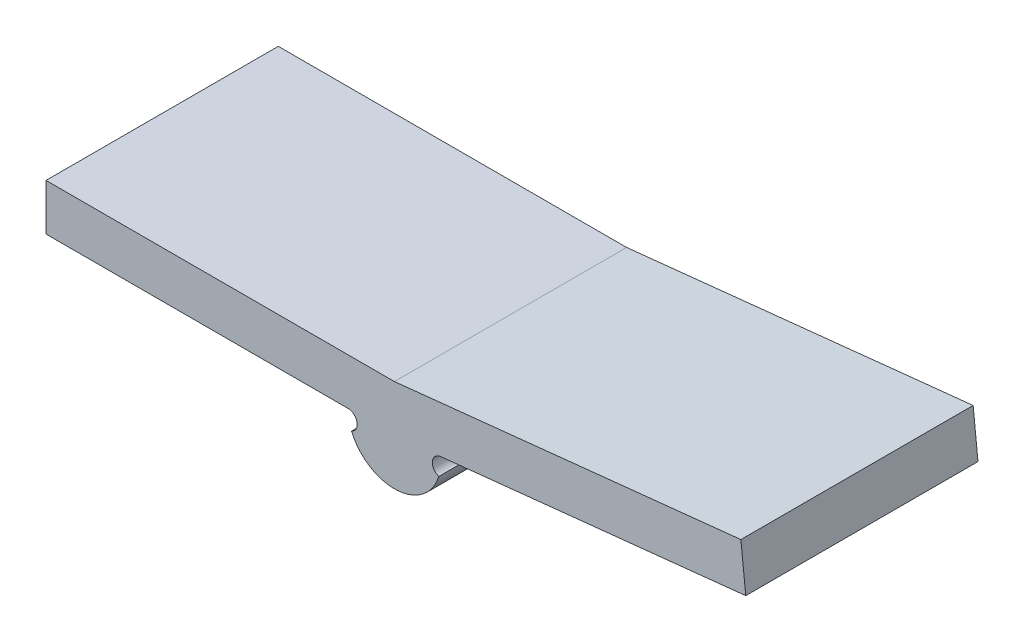
from build123d import *

# Parameters (mm, degrees)
BOSS_EXTRUDE1_DEPTH = 50
CUT_EXTRUDE1_DEPTH  = 50


with BuildPart() as part:
    # Sketch2 → Boss-Extrude1 (new body)
    with BuildSketch(Plane.XY):
        with BuildLine():
            Line((-133.871822526, 14.839434035), (-58.871822526, 14.839434035))
            Line((-58.871822526, 14.839434035), (15.717319626, 22.67906878))
            Line((15.717319626, 22.67906878), (16.762604259, 12.733849826))
            Line((16.762604259, 12.733849826), (-48.921026621, 5.830222033))
            ThreePointArc((-48.921026621, 5.830222033), (-58.375818015, -5.148257366), (-68.871822526, 4.839434035))
            Line((-68.871822526, 4.839434035), (-133.871822526, 4.839434035))
            Line((-133.871822526, 4.839434035), (-133.871822526, 14.839434035))
        make_face()
    extrude(amount=BOSS_EXTRUDE1_DEPTH)

    # Sketch4 → Cut-Extrude1 (cut)
    with BuildSketch(Plane.XY.offset(50)):
        with BuildLine():
            Line((-68.871822526, 0.839434035), (-68.871822526, 4.839434035))
            ThreePointArc((-68.871822526, 4.839434035), (-66.871822526, 2.839434035), (-68.871822526, 0.839434035))
        make_face()
        with BuildLine():
            Line((-48.502912768, 1.852134452), (-48.921026621, 5.830222033))
            ThreePointArc((-48.921026621, 5.830222033), (-50.701013486, 3.632121316), (-48.502912768, 1.852134452))
        make_face()
    extrude(amount=-CUT_EXTRUDE1_DEPTH, mode=Mode.SUBTRACT)


solid = part.part
